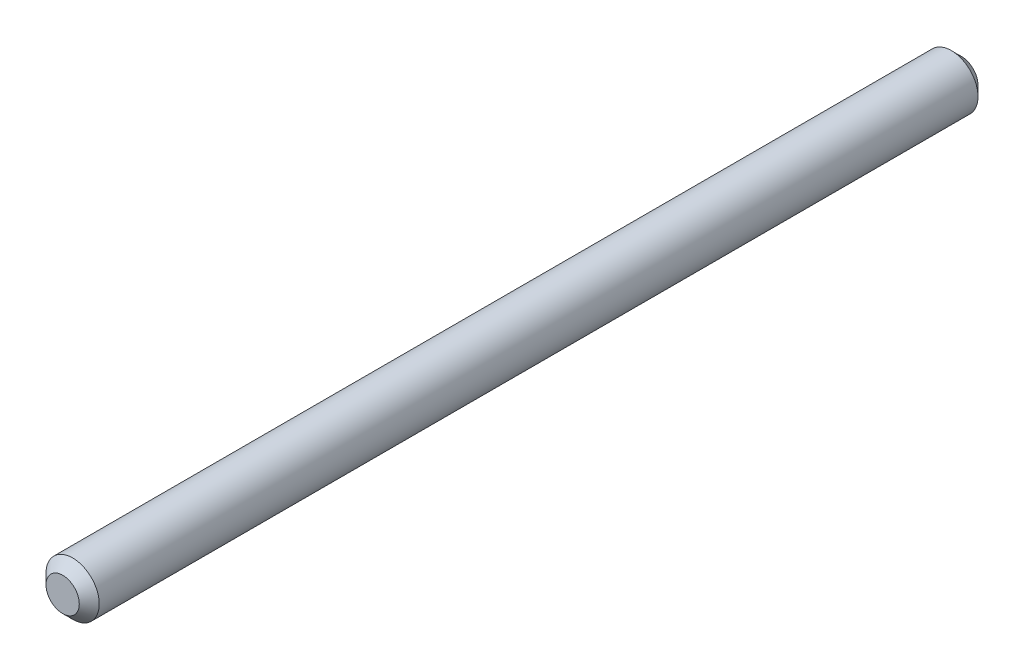
from build123d import *

# Parameters (mm, degrees)
ESQUISSE1_R        = 1
BOSS_EXTRU_1_DEPTH = 33.75
CHANFREIN1_SIZE    = 0.375


with BuildPart() as part:
    # Esquisse1 → Boss.-Extru.1 (new body)
    with BuildSketch(Plane.XY):
        Circle(ESQUISSE1_R)
    extrude(amount=BOSS_EXTRU_1_DEPTH)

    # Chanfrein1
    chanfrein1_edges = [part.edges().sort_by_distance(p)[0] for p in [
        (-1, 0, 0),
        (-1, 0, 33.75),
    ]]
    chamfer(chanfrein1_edges, length=CHANFREIN1_SIZE)


solid = part.part
